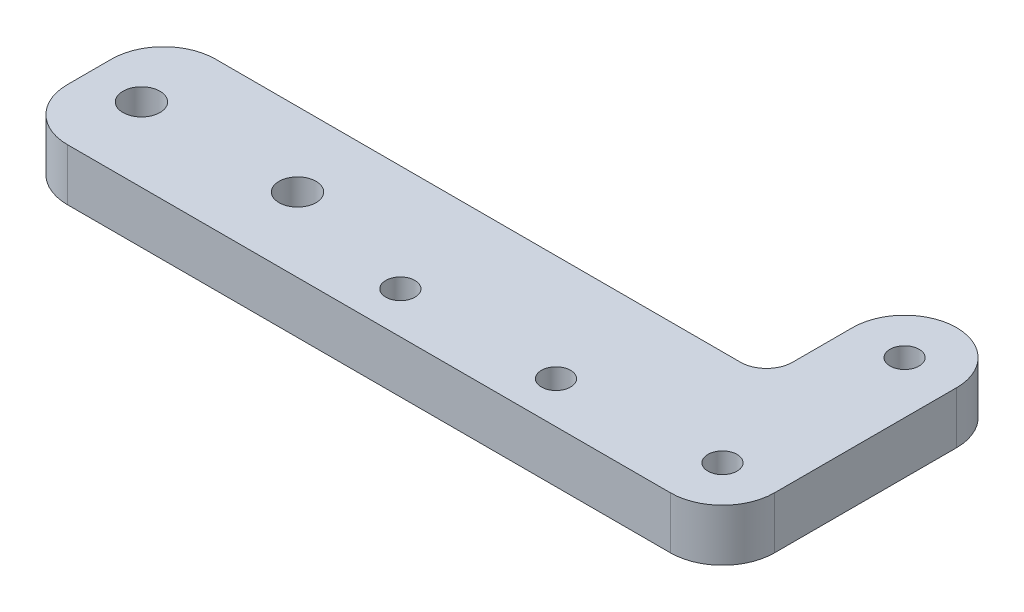
from build123d import *

# Parameters (mm, degrees)
SKETCH1_R           = 0.889
SKETCH1_R_2         = 1.1303
BOSS_EXTRUDE1_DEPTH = 3.175


with BuildPart() as part:
    # Sketch1 → Boss-Extrude1 (new body)
    with BuildSketch(Plane(origin=(0, 0, 0), x_dir=(1, 0, 0), z_dir=(0, 1, 0))):
        with BuildLine():
            Line((14.23308304, 5.815984864), (14.23308304, -5.296515136))
            ThreePointArc((14.23308304, -5.296515136), (13.30314707, -7.541579166), (11.05808304, -8.471515136))
            Line((11.05808304, -8.471515136), (-25.74691696, -8.471515136))
            ThreePointArc((-25.74691696, -8.471515136), (-27.99198099, -7.541579166), (-28.92191696, -5.296515136))
            Line((-28.92191696, -5.296515136), (-28.92191696, -2.606515136))
            ThreePointArc((-28.92191696, -2.606515136), (-27.99198099, -0.361451106), (-25.74691696, 0.568484864))
            Line((-25.74691696, 0.568484864), (6.29558304, 0.568484864))
            ThreePointArc((6.29558304, 0.568484864), (7.418115055, 1.033452849), (7.88308304, 2.155984864))
            Line((7.88308304, 2.155984864), (7.88308304, 5.815984864))
            ThreePointArc((7.88308304, 5.815984864), (11.05808304, 8.990984864), (14.23308304, 5.815984864))
        make_face()
        with Locations(Location((-7.96691696, -5.931515136, 0), (0, 0, 270))):
            Circle(SKETCH1_R, mode=Mode.SUBTRACT)
        with Locations(Location((1.53308304, -5.931515136, 0), (0, 0, 270))):
            Circle(SKETCH1_R, mode=Mode.SUBTRACT)
        with Locations(Location((11.05808304, 5.815984864, 0), (0, 0, 270))):
            Circle(SKETCH1_R, mode=Mode.SUBTRACT)
        with Locations(Location((-25.74691696, -3.951515136, 0), (0, 0, 270))):
            Circle(SKETCH1_R_2, mode=Mode.SUBTRACT)
        with Locations(Location((-16.22191696, -3.951515136, 0), (0, 0, 270))):
            Circle(SKETCH1_R_2, mode=Mode.SUBTRACT)
        with Locations(Location((11.05808304, -5.296515136, 0), (0, 0, 270))):
            Circle(SKETCH1_R, mode=Mode.SUBTRACT)
    extrude(amount=BOSS_EXTRUDE1_DEPTH)


solid = part.part
